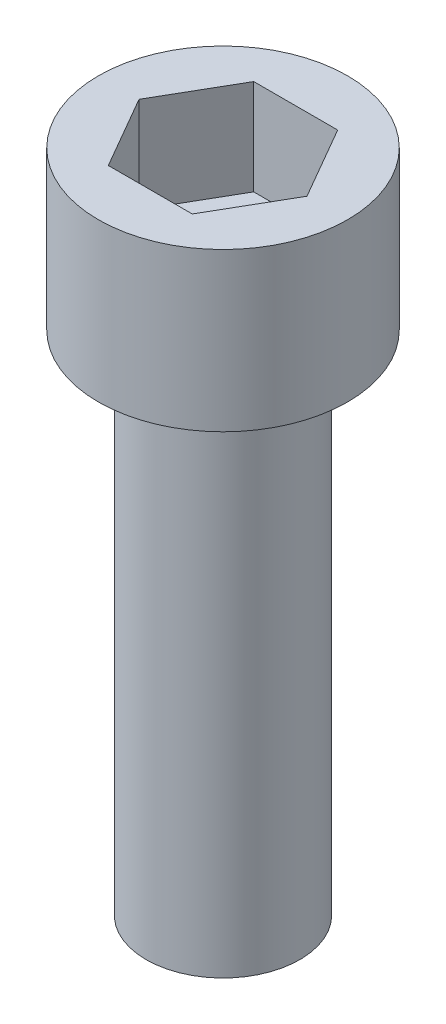
from build123d import *

# Parameters (mm, degrees)
CUT_EXTRUDE1_DEPTH = 2.921


with BuildPart() as part:
    # Sketch2 → Revolve1 (revolve)
    with BuildSketch(Plane(origin=(0, 0, 0), x_dir=(0, 0, -1), z_dir=(1, 0, 0)), mode=Mode.PRIVATE) as revolve1_sk:
        Polygon((0, 0), (2.3495, 0), (2.3495, 15.494), (3.81, 15.494), (3.81, 20.32), (0, 20.32), align=None)
    revolve(revolve1_sk.sketch.rotate(Axis((0, 20.32, 0), (0, -1, 0)), 180), axis=Axis((0, 20.32, 0), (0, -1, 0)))

    # Sketch3 → Cut-Extrude1 (cut)
    with BuildSketch(Plane(origin=(0, 20.32, 0), x_dir=(1, 0, 0), z_dir=(0, 1, 0))):
        Polygon((1.283160973, -2.2225), (2.566321947, 0), (1.283160973, 2.2225), (-1.283160973, 2.2225), (-2.566321947, 0), (-1.283160973, -2.2225), align=None)
    extrude(amount=-CUT_EXTRUDE1_DEPTH, mode=Mode.SUBTRACT)


solid = part.part
